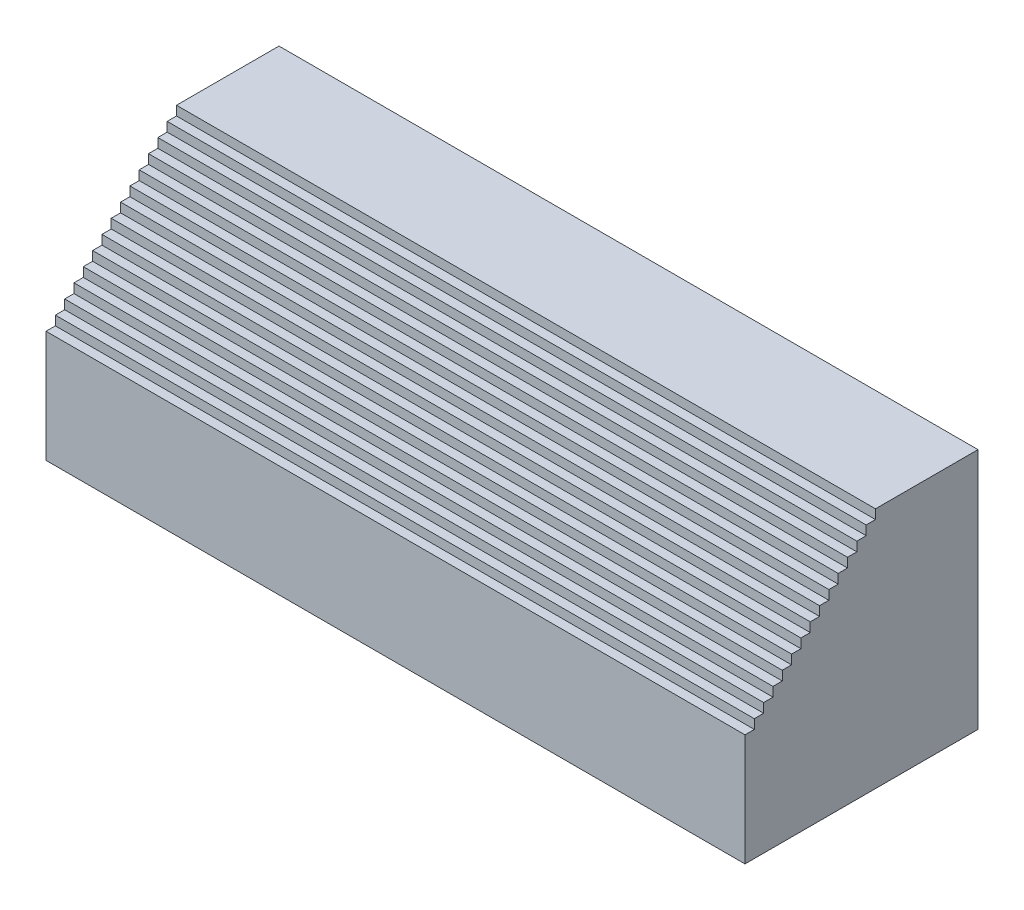
from build123d import *

# Parameters (mm, degrees)
SKETCH_1_W          = 15
SKETCH_1_H          = 5
EXTRUDE_1_DEPTH     = 5.2
CUT_EXTRUDE_1_DEPTH = 17.071403175


with BuildPart() as part:
    # 草图1 → 凸台-拉伸1 (new body)
    with BuildSketch(Plane(origin=(0, 0, 0), x_dir=(1, 0, 0), z_dir=(0, 1, 0))):
        Rectangle(SKETCH_1_W, SKETCH_1_H)
    extrude(amount=EXTRUDE_1_DEPTH)

    # 草图6 → 切除-拉伸1 (cut, through all)
    with BuildSketch(Plane(origin=(7.5, 0, 0), x_dir=(0, 0, -1), z_dir=(1, 0, 0))):
        Polygon((-2.5, 2.4), (-2.3, 2.4), (-2.3, 2.6), (-2.1, 2.6), (-2.1, 2.8), (-1.9, 2.8), (-1.9, 3), (-1.7, 3), (-1.7, 3.2), (-1.5, 3.2), (-1.5, 3.4), (-1.3, 3.4), (-1.3, 3.6), (-1.1, 3.6), (-1.1, 3.8), (-0.9, 3.8), (-0.9, 4), (-0.7, 4), (-0.7, 4.2), (-0.5, 4.2), (-0.5, 4.4), (-0.3, 4.4), (-0.3, 4.6), (-0.1, 4.6), (-0.1, 4.8), (0.100331193, 4.8), (0.100331193, 5), (0.300331193, 5), (0.300331193, 5.2), (-2.5, 5.2), align=None)
    extrude(amount=-CUT_EXTRUDE_1_DEPTH, mode=Mode.SUBTRACT)


solid = part.part
